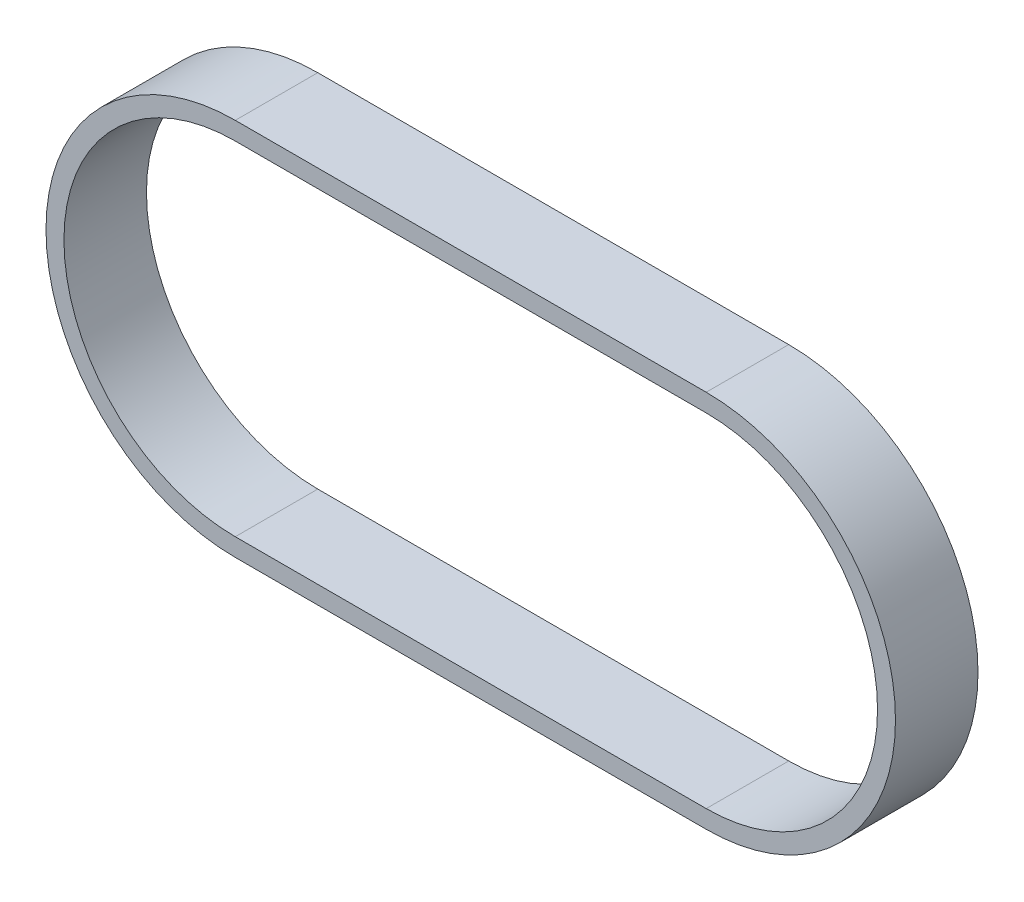
from build123d import *

# Parameters (mm, degrees)
EXTRUDE_THIN1_DEPTH = 9.2


with BuildPart() as part:
    # Sketch1 → Extrude-Thin1 (new body)
    with BuildSketch(Plane.XY):
        with BuildLine():
            Line((0, 21.1), (52.5, 21.1))
            ThreePointArc((52.5, 21.1), (73.6, 0), (52.5, -21.1))
            Line((52.5, -21.1), (0, -21.1))
            ThreePointArc((0, -21.1), (-21.1, 0), (0, 21.1))
        make_face()
        with BuildLine():
            Line((0, 19.1), (52.5, 19.1))
            ThreePointArc((52.5, 19.1), (71.6, 0), (52.5, -19.1))
            Line((52.5, -19.1), (0, -19.1))
            ThreePointArc((0, -19.1), (-19.1, 0), (0, 19.1))
        make_face(mode=Mode.SUBTRACT)
    extrude(amount=EXTRUDE_THIN1_DEPTH)


solid = part.part
